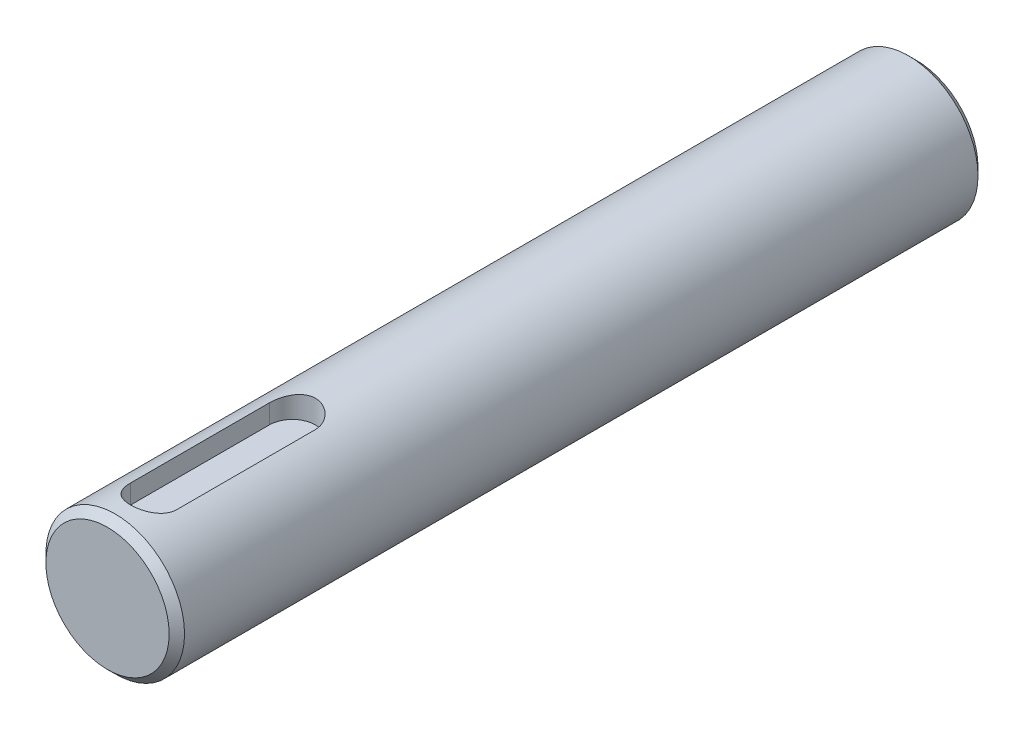
from build123d import *

# Parameters (mm, degrees)
IZIM1_R                     = 9
Y_KSEKLIK_EKSTR_ZYON1_DEPTH = 105
PAH1_SIZE                   = 1
KES_EKSTR_ZYON1_START       = 6
KES_EKSTR_ZYON1_DEPTH       = 100.768615383


with BuildPart() as part:
    # Çizim1 → Yükseklik-Ekstrüzyon1 (new body)
    with BuildSketch(Plane.XY):
        Circle(IZIM1_R)
    extrude(amount=Y_KSEKLIK_EKSTR_ZYON1_DEPTH)

    # Pah1
    pah1_edges = [part.edges().sort_by_distance(p)[0] for p in [
        (-9, 0, 0),
        (-9, 0, 105),
    ]]
    chamfer(pah1_edges, length=PAH1_SIZE)

    # Çizim2 → Kes-Ekstrüzyon1 (cut, through all)
    with BuildSketch(Plane(origin=(0, 0, 0), x_dir=(1, 0, 0), z_dir=(0, 1, 0)).offset(KES_EKSTR_ZYON1_START)):
        with BuildLine():
            Line((3, -81), (3, -99))
            ThreePointArc((3, -99), (0, -102), (-3, -99))
            Line((-3, -99), (-3, -81))
            ThreePointArc((-3, -81), (0, -78), (3, -81))
        make_face()
    extrude(amount=KES_EKSTR_ZYON1_DEPTH, mode=Mode.SUBTRACT)


solid = part.part
